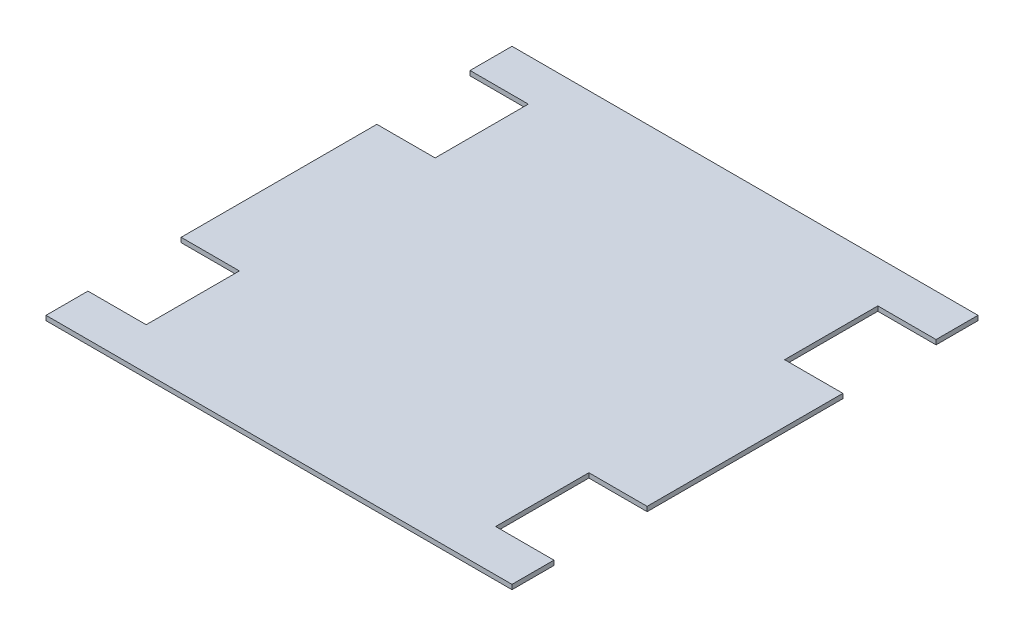
from build123d import *

# Parameters (mm, degrees)
SKETCH1_W           = 500
SKETCH1_H           = 500
BOSS_EXTRUDE1_DEPTH = 5
CUT_EXTRUDE1_DEPTH  = 5


with BuildPart() as part:
    # Sketch1 → Boss-Extrude1 (new body)
    with BuildSketch(Plane(origin=(0, 0, 0), x_dir=(1, 0, 0), z_dir=(0, 1, 0))):
        Rectangle(SKETCH1_W, SKETCH1_H)
    extrude(amount=BOSS_EXTRUDE1_DEPTH)

    # Sketch3 → Cut-Extrude1 (cut)
    with BuildSketch(Plane(origin=(0, 5, 0), x_dir=(1, 0, 0), z_dir=(0, 1, 0))):
        Polygon((-187.5, 205), (-250, 205), (-250, 155), (-250, 105), (-187.5, 105), align=None)
        Polygon((-187.5, -105), (-250, -105), (-250, -155), (-250, -205), (-187.5, -205), align=None)
        Polygon((250, -155), (250, -105), (187.5, -105), (187.5, -205), (250, -205), align=None)
        Polygon((250, 155), (250, 205), (187.5, 205), (187.5, 105), (250, 105), align=None)
    extrude(amount=-CUT_EXTRUDE1_DEPTH, mode=Mode.SUBTRACT)


solid = part.part
